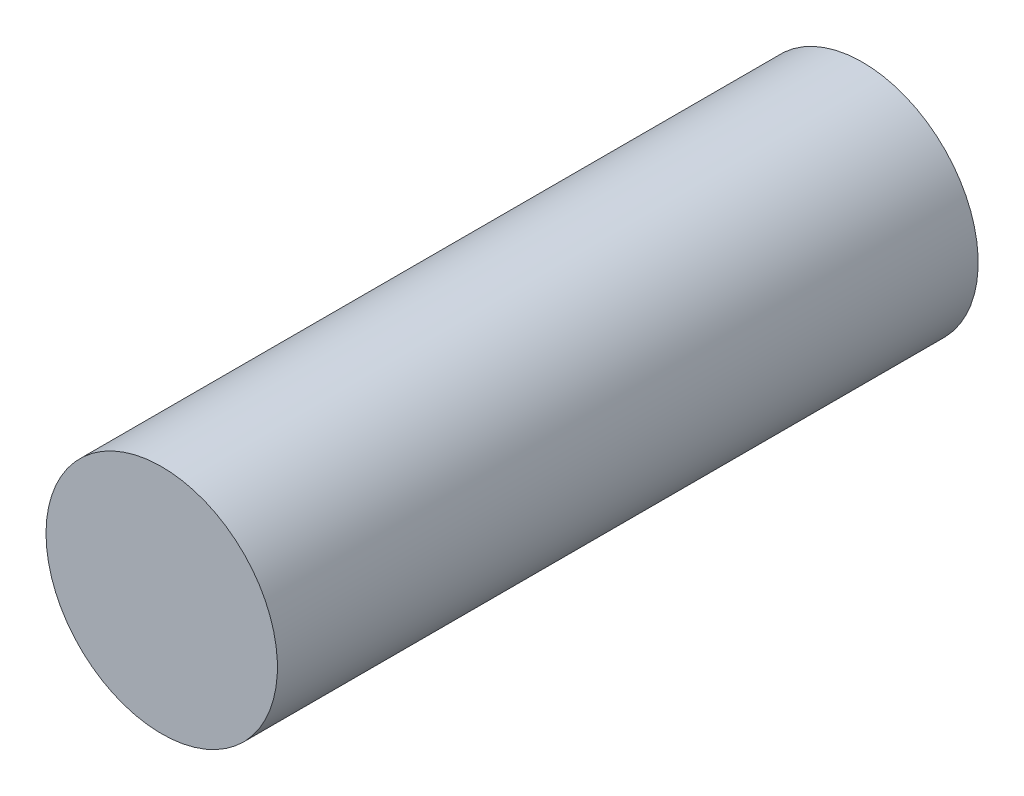
from build123d import *

# Parameters (mm, degrees)
CROQUIS1_R              = 7.15
SALIENTE_EXTRUIR1_DEPTH = 43.3


with BuildPart() as part:
    # Croquis1 → Saliente-Extruir1 (new body)
    with BuildSketch(Plane.XY):
        with Locations(Location((0, 0, 0), (0, 0, 180))):
            Circle(CROQUIS1_R)
    extrude(amount=SALIENTE_EXTRUIR1_DEPTH)


solid = part.part
